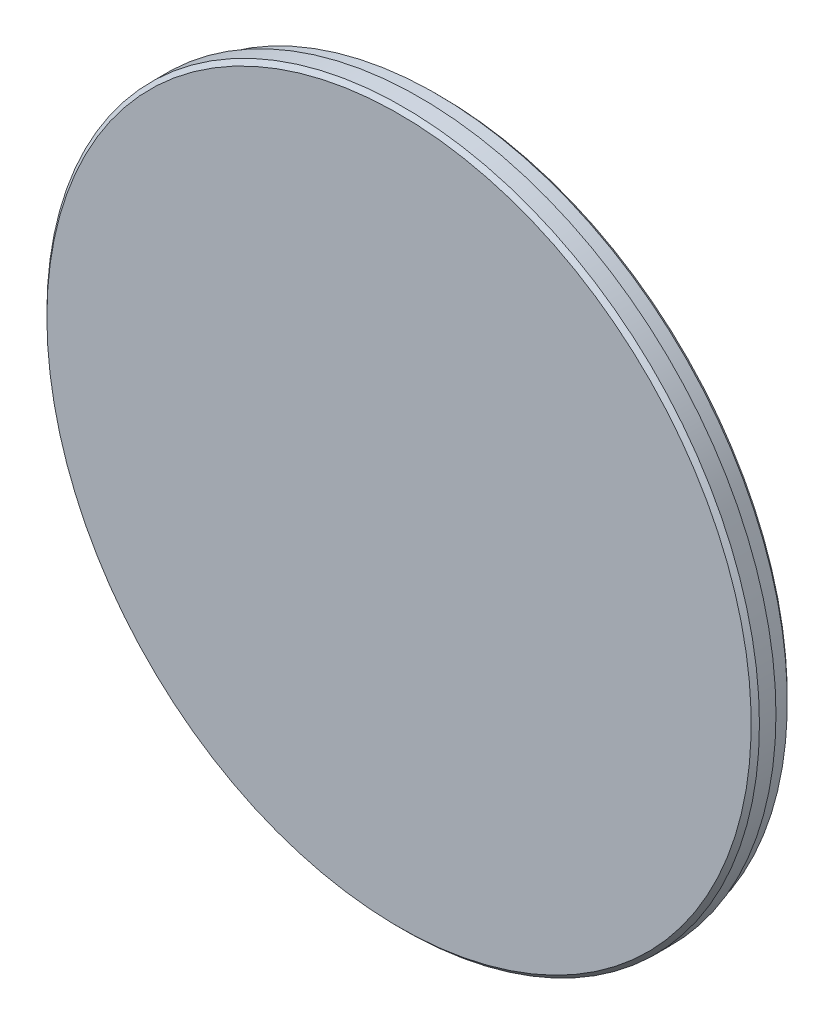
from build123d import *

# Parameters (mm, degrees)
SKETCH1_R           = 17.25
BOSS_EXTRUDE1_DEPTH = 1
SKETCH2_R           = 17
BOSS_EXTRUDE2_DEPTH = 1
CHAMFER1_SIZE       = 0.2


with BuildPart() as part:
    # Sketch1 → Boss-Extrude1 (new body)
    with BuildSketch(Plane.XY):
        Circle(SKETCH1_R)
    extrude(amount=-BOSS_EXTRUDE1_DEPTH)

    # Sketch2 → Boss-Extrude2 (add)
    with BuildSketch(Plane(origin=(0, 0, -1), x_dir=(-1, 0, 0), z_dir=(0, 0, -1))):
        Circle(SKETCH2_R)
    extrude(amount=BOSS_EXTRUDE2_DEPTH)

    # Chamfer1
    chamfer1_edges = [part.edges().sort_by_distance(p)[0] for p in [
        (-17.25, 0, 0),
        (17, 0, -2),
    ]]
    chamfer(chamfer1_edges, length=CHAMFER1_SIZE)


solid = part.part
